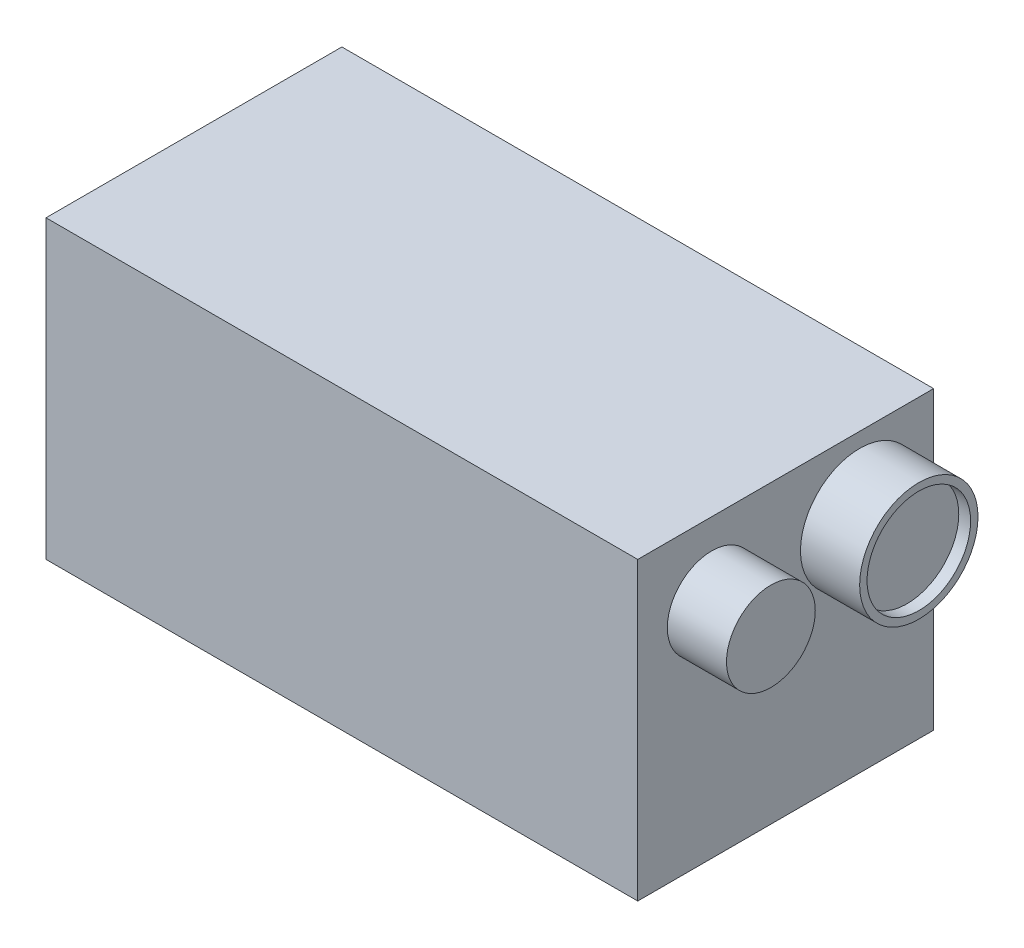
from build123d import *

# Parameters (mm, degrees)
SKETCH_1_W          = 100
SKETCH_1_H          = 50
EXTRUDE_1_DEPTH     = 25
SKETCH_2_R          = 10
SKETCH_2_R_2        = 7.5
EXTRUDE_2_DEPTH     = 10
SKETCH_3_R          = 8.75
CUT_EXTRUDE_1_DEPTH = 2


with BuildPart() as part:
    # 스케치1 → 보스-돌출1 (new, symmetric)
    with BuildSketch(Plane.XY):
        Rectangle(SKETCH_1_W, SKETCH_1_H)
    extrude(amount=EXTRUDE_1_DEPTH, both=True)

    # 스케치2 → 보스-돌출2 (add)
    with BuildSketch(Plane(origin=(50, 0, 0), x_dir=(0, 0, -1), z_dir=(1, 0, 0))):
        with Locations(Location((12.5, 12.5, 0), (0, 0, 180))):
            Circle(SKETCH_2_R)
        with Locations(Location((-12.5, 12.5, 0), (0, 0, 180))):
            Circle(SKETCH_2_R_2)
    extrude(amount=EXTRUDE_2_DEPTH)

    # 스케치3 → 컷-돌출1 (cut)
    with BuildSketch(Plane(origin=(60, 0, 0), x_dir=(0, 0, -1), z_dir=(1, 0, 0))):
        with Locations((12.5, 12.5)):
            Circle(SKETCH_3_R)
    extrude(amount=-CUT_EXTRUDE_1_DEPTH, mode=Mode.SUBTRACT)


solid = part.part
